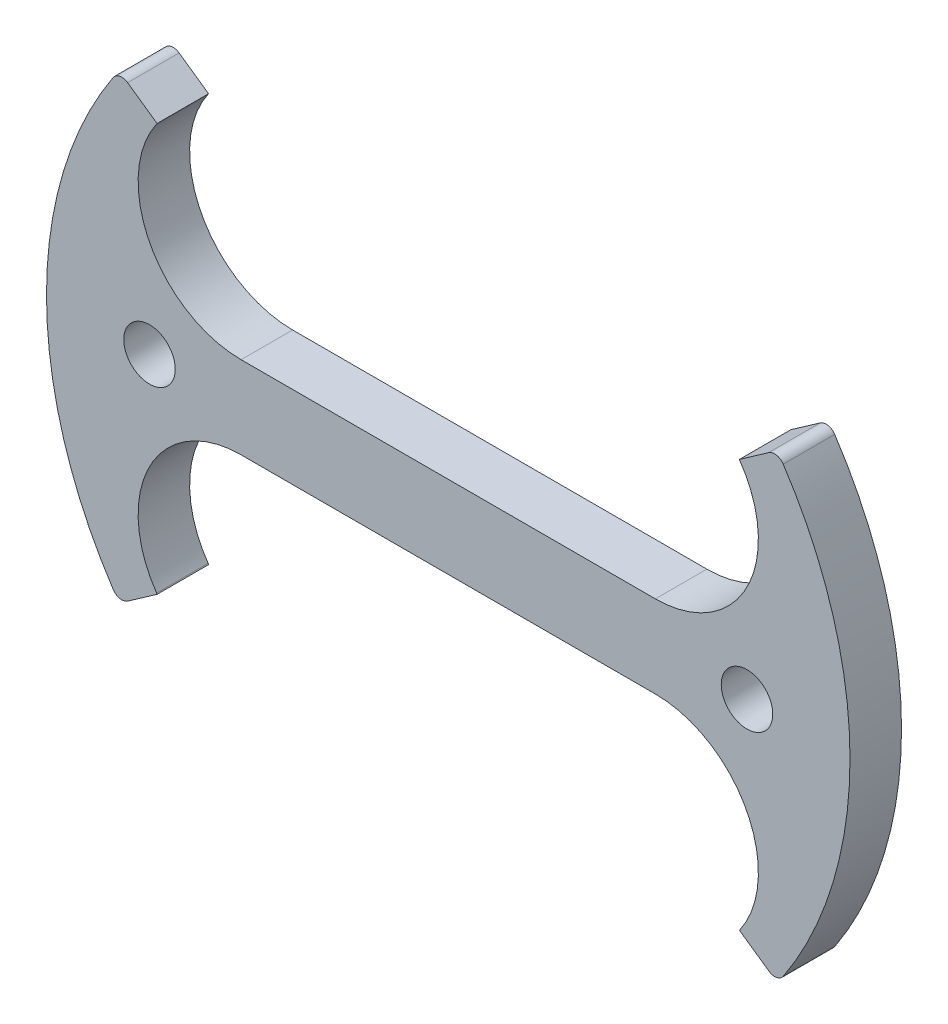
from build123d import *

# Parameters (mm, degrees)
SKETCH1_R           = 49.53
BOSS_EXTRUDE2_DEPTH = 6.35
FILLET2_R           = 12.7
FILLET3_R           = 12.7
FILLET4_R           = 12.7
FILLET5_R           = 12.7
CUT_EXTRUDE1_DEPTH  = 6.35
SKETCH3_R           = 3.175
CUT_EXTRUDE2_DEPTH  = 6.35
FILLET6_R           = 1.27
FILLET7_R           = 1.27
FILLET8_R           = 1.27
FILLET9_R           = 1.27


with BuildPart() as part:
    # Sketch1 → Boss-Extrude2 (new body)
    with BuildSketch(Plane.XY):
        Circle(SKETCH1_R)
        with BuildLine():
            Line((-43.519510854, 5.08), (43.519510854, 5.08))
            ThreePointArc((43.519510854, 5.08), (0, 43.815), (-43.519510854, 5.08))
        make_face(mode=Mode.SUBTRACT)
        with BuildLine():
            Line((-43.519510854, -5.08), (43.519510854, -5.08))
            ThreePointArc((43.519510854, -5.08), (0, -43.815), (-43.519510854, -5.08))
        make_face(mode=Mode.SUBTRACT)
    extrude(amount=BOSS_EXTRUDE2_DEPTH)

    # Fillet2
    fillet2_edges = [part.edges().sort_by_distance(p)[0] for p in [
        (43.519510854, 5.08, 3.175),
    ]]
    fillet(fillet2_edges, radius=FILLET2_R)

    # Fillet3
    fillet3_edges = [part.edges().sort_by_distance(p)[0] for p in [
        (-43.519510854, 5.08, 3.175),
    ]]
    fillet(fillet3_edges, radius=FILLET3_R)

    # Fillet4
    fillet4_edges = [part.edges().sort_by_distance(p)[0] for p in [
        (43.519510854, -5.08, 3.175),
    ]]
    fillet(fillet4_edges, radius=FILLET4_R)

    # Fillet5
    fillet5_edges = [part.edges().sort_by_distance(p)[0] for p in [
        (-43.519510854, -5.08, 3.175),
    ]]
    fillet(fillet5_edges, radius=FILLET5_R)

    # Sketch2 → Cut-Extrude1 (cut)
    with BuildSketch(Plane(origin=(0, 0, 0), x_dir=(-1, 0, 0), z_dir=(0, 0, -1))):
        with BuildLine():
            Line((-40.581029215, -28.3972), (-35.898602767, -25.1206))
            ThreePointArc((-35.898602767, -25.1206), (-0.013001801, -43.814998071), (35.883687713, -25.141900904))
            Line((35.883687713, -25.141900904), (40.564168719, -28.421279283))
            ThreePointArc((40.564168719, -28.421279283), (-0.014697689, -49.529997819), (-40.581029215, -28.3972))
        make_face()
        with BuildLine():
            Line((-40.564168719, 28.421279283), (-35.883687713, 25.141900904))
            ThreePointArc((-35.883687713, 25.141900904), (0.013001801, 43.814998071), (35.898602767, 25.1206))
            Line((35.898602767, 25.1206), (40.581029215, 28.3972))
            ThreePointArc((40.581029215, 28.3972), (0.014697689, 49.529997819), (-40.564168719, 28.421279283))
        make_face()
    extrude(amount=-CUT_EXTRUDE1_DEPTH, mode=Mode.SUBTRACT)

    # Sketch3 → Cut-Extrude2 (cut)
    with BuildSketch(Plane(origin=(0, 0, 0), x_dir=(-1, 0, 0), z_dir=(0, 0, -1))):
        with Locations((-36.83, 0)):
            Circle(SKETCH3_R)
        with Locations(Location((36.83, 0, 0), (0, 0, 180))):
            Circle(SKETCH3_R)
    extrude(amount=-CUT_EXTRUDE2_DEPTH, mode=Mode.SUBTRACT)

    # Fillet6
    fillet6_edges = [part.edges().sort_by_distance(p)[0] for p in [
        (-40.581029215, 28.3972, 3.175),
    ]]
    fillet(fillet6_edges, radius=FILLET6_R)

    # Fillet7
    fillet7_edges = [part.edges().sort_by_distance(p)[0] for p in [
        (-40.564168719, -28.421279283, 3.175),
    ]]
    fillet(fillet7_edges, radius=FILLET7_R)

    # Fillet8
    fillet8_edges = [part.edges().sort_by_distance(p)[0] for p in [
        (40.581029215, -28.3972, 3.175),
    ]]
    fillet(fillet8_edges, radius=FILLET8_R)

    # Fillet9
    fillet9_edges = [part.edges().sort_by_distance(p)[0] for p in [
        (40.564168719, 28.421279283, 3.175),
    ]]
    fillet(fillet9_edges, radius=FILLET9_R)


solid = part.part
